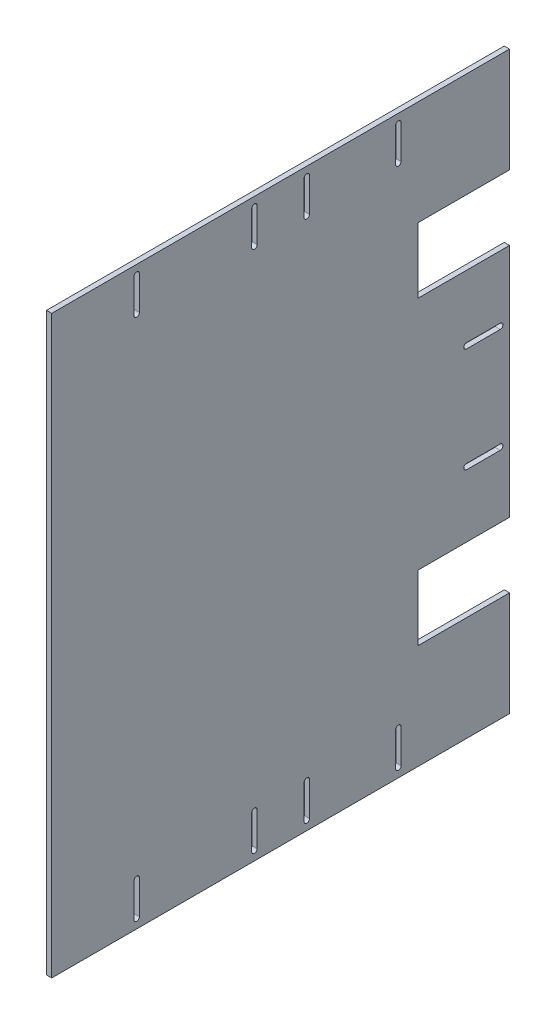
from build123d import *

# Parameters (mm, degrees)
BOSS_EXTRUDE1_DEPTH = 4


with BuildPart() as part:
    # Sketch1 → Boss-Extrude1 (new body)
    with BuildSketch(Plane.YZ):
        Polygon((0, 350), (0, 0), (80, 0), (80, 70), (130, 70), (130, 0), (310, 0), (310, 70), (360, 70), (360, 0), (440, 0), (440, 350), align=None)
        with BuildLine():
            Line((7.1, 87.1), (32.9, 87.1))
            ThreePointArc((32.9, 87.1), (35, 85), (32.9, 82.9))
            Line((32.9, 82.9), (7.1, 82.9))
            ThreePointArc((7.1, 82.9), (5, 85), (7.1, 87.1))
        make_face(mode=Mode.SUBTRACT)
        with BuildLine():
            Line((177.9, 7.1), (177.9, 32.9))
            ThreePointArc((177.9, 32.9), (180, 35), (182.1, 32.9))
            Line((182.1, 32.9), (182.1, 7.1))
            ThreePointArc((182.1, 7.1), (180, 5), (177.9, 7.1))
        make_face(mode=Mode.SUBTRACT)
        with BuildLine():
            ThreePointArc((32.9, 157.1), (35, 155), (32.9, 152.9))
            Line((32.9, 152.9), (7.1, 152.9))
            ThreePointArc((7.1, 152.9), (5, 155), (7.1, 157.1))
            Line((7.1, 157.1), (32.9, 157.1))
        make_face(mode=Mode.SUBTRACT)
        with BuildLine():
            ThreePointArc((257.9, 32.9), (260, 35), (262.1, 32.9))
            Line((262.1, 32.9), (262.1, 7.1))
            ThreePointArc((262.1, 7.1), (260, 5), (257.9, 7.1))
            Line((257.9, 7.1), (257.9, 32.9))
        make_face(mode=Mode.SUBTRACT)
        with BuildLine():
            ThreePointArc((407.1, 82.9), (405, 85), (407.1, 87.1))
            Line((407.1, 87.1), (432.9, 87.1))
            ThreePointArc((432.9, 87.1), (435, 85), (432.9, 82.9))
            Line((432.9, 82.9), (407.1, 82.9))
        make_face(mode=Mode.SUBTRACT)
        with BuildLine():
            Line((432.9, 152.9), (407.1, 152.9))
            ThreePointArc((407.1, 152.9), (405, 155), (407.1, 157.1))
            Line((407.1, 157.1), (432.9, 157.1))
            ThreePointArc((432.9, 157.1), (435, 155), (432.9, 152.9))
        make_face(mode=Mode.SUBTRACT)
        with BuildLine():
            Line((7.1, 197.1), (32.9, 197.1))
            ThreePointArc((32.9, 197.1), (35, 195), (32.9, 192.9))
            Line((32.9, 192.9), (7.1, 192.9))
            ThreePointArc((7.1, 192.9), (5, 195), (7.1, 197.1))
        make_face(mode=Mode.SUBTRACT)
        with BuildLine():
            ThreePointArc((32.9, 287.1), (35, 285), (32.9, 282.9))
            Line((32.9, 282.9), (7.1, 282.9))
            ThreePointArc((7.1, 282.9), (5, 285), (7.1, 287.1))
            Line((7.1, 287.1), (32.9, 287.1))
        make_face(mode=Mode.SUBTRACT)
        with BuildLine():
            ThreePointArc((407.1, 192.9), (405, 195), (407.1, 197.1))
            Line((407.1, 197.1), (432.9, 197.1))
            ThreePointArc((432.9, 197.1), (435, 195), (432.9, 192.9))
            Line((432.9, 192.9), (407.1, 192.9))
        make_face(mode=Mode.SUBTRACT)
        with BuildLine():
            Line((432.9, 282.9), (407.1, 282.9))
            ThreePointArc((407.1, 282.9), (405, 285), (407.1, 287.1))
            Line((407.1, 287.1), (432.9, 287.1))
            ThreePointArc((432.9, 287.1), (435, 285), (432.9, 282.9))
        make_face(mode=Mode.SUBTRACT)
    extrude(amount=BOSS_EXTRUDE1_DEPTH)


solid = part.part
